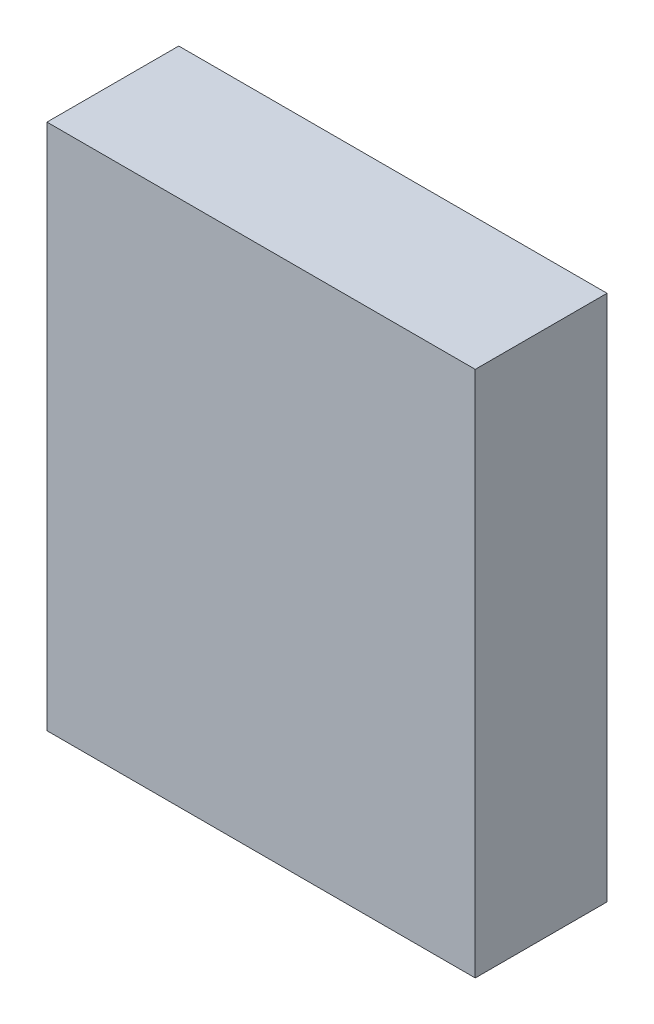
from build123d import *

# Parameters (mm, degrees)
SCHIZZO1_W                   = 65
SCHIZZO1_H                   = 80
ESTRUSIONE_ESTRUSIONE3_DEPTH = 20
SCHIZZO4_W                   = 61
SCHIZZO4_H                   = 76
TAGLIO_ESTRUSIONE5_DEPTH     = 18
SCHIZZO6_W                   = 11
SCHIZZO6_H                   = 8.5
TAGLIO_ESTRUSIONE8_DEPTH     = 3
SCHIZZO7_R                   = 5.182753919
ESTRUSIONE_ESTRUSIONE6_DEPTH = 17


with BuildPart() as part:
    # Schizzo1 → Estrusione-Estrusione3 (new body)
    with BuildSketch(Plane.XY):
        with Locations((-250.828848217, 316.320789782)):
            Rectangle(SCHIZZO1_W, SCHIZZO1_H)
    extrude(amount=ESTRUSIONE_ESTRUSIONE3_DEPTH)

    # Schizzo4 → Taglio-Estrusione5 (cut)
    with BuildSketch(Plane(origin=(0, 0, 0), x_dir=(-1, 0, 0), z_dir=(0, 0, -1))):
        with Locations((250.785132486, 316.761133349)):
            Rectangle(SCHIZZO4_W, SCHIZZO4_H)
    extrude(amount=-TAGLIO_ESTRUSIONE5_DEPTH, mode=Mode.SUBTRACT)

    # Schizzo6 → Taglio-Estrusione8 (cut)
    with BuildSketch(Plane(origin=(0, 276.320789782, 0), x_dir=(-1, 0, 0), z_dir=(0, -1, 0))):
        with Locations((254.830379364, -3.404987236)):
            Rectangle(SCHIZZO6_W, SCHIZZO6_H)
    extrude(amount=-TAGLIO_ESTRUSIONE8_DEPTH, mode=Mode.SUBTRACT)

    # Schizzo7 → Estrusione-Estrusione6 (add)
    with BuildSketch(Plane(origin=(0, 0, 18), x_dir=(-1, 0, 0), z_dir=(0, 0, -1))):
        with Locations(Location((251.224275907, 345.746509499, 0), (0, 0, 180))):
            Circle(SCHIZZO7_R)
    extrude(amount=ESTRUSIONE_ESTRUSIONE6_DEPTH)


solid = part.part
